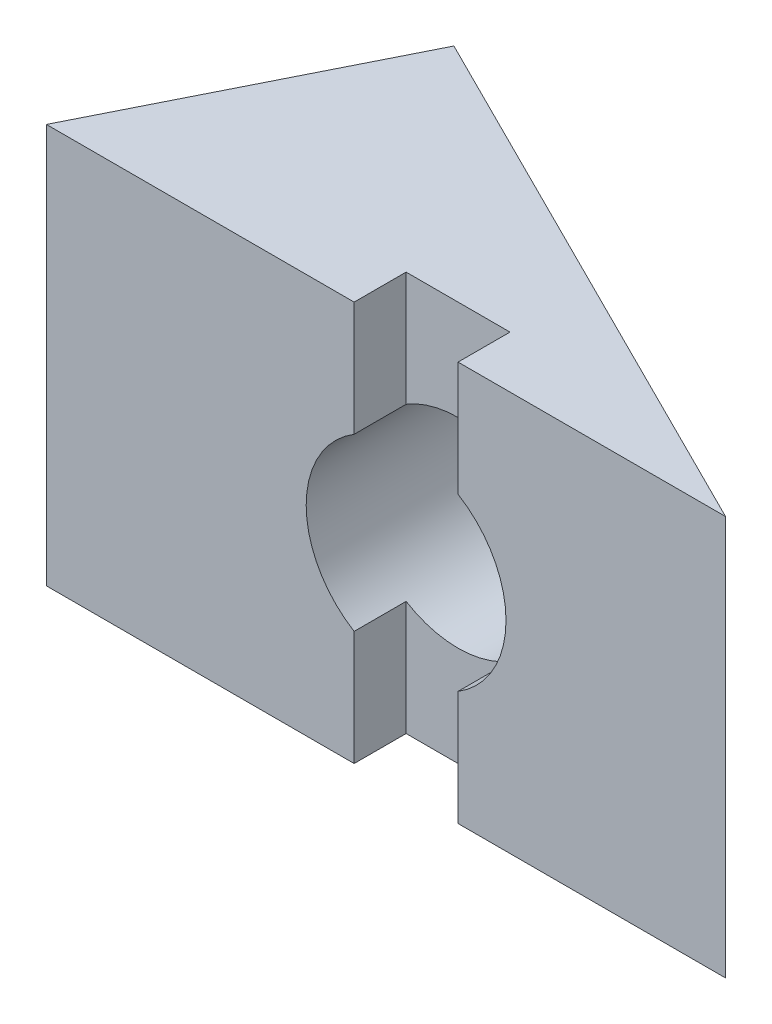
from build123d import *

# Parameters (mm, degrees)
ESTRUSIONE_ESTRUSIONE1_DEPTH = 100
TAGLIO_ESTRUSIONE2_DEPTH     = 13
SCHIZZO5_R                   = 25
TAGLIO_ESTRUSIONE3_DEPTH     = 169.564420887


with BuildPart() as part:
    # Schizzo1 → Estrusione-Estrusione1 (new body)
    with BuildSketch(Plane(origin=(0, 0, 0), x_dir=(1, 0, 0), z_dir=(0, 1, 0))):
        Polygon((-52.496864645, -55.39158852), (117.444301645, -55.39158852), (-18.508631387, 12.584877996), align=None)
    extrude(amount=ESTRUSIONE_ESTRUSIONE1_DEPTH)

    # Schizzo2 → Taglio-Estrusione2 (cut)
    with BuildSketch(Plane.XY.offset(55.39158852)):
        with BuildLine():
            Line((50.503135355, 100), (37.503135355, 100))
            Line((37.503135355, 100), (37.503135355, 75))
            ThreePointArc((37.503135355, 75), (44.253916325, 74.071289045), (50.503135355, 71.354156504))
            Line((50.503135355, 71.354156504), (50.503135355, 100))
        make_face()
        with BuildLine():
            Line((37.503135355, 75), (37.503135355, 100))
            Line((37.503135355, 100), (24.503135355, 100))
            Line((24.503135355, 100), (24.503135355, 71.354156504))
            ThreePointArc((24.503135355, 71.354156504), (30.752354386, 74.071289045), (37.503135355, 75))
        make_face()
        with BuildLine():
            ThreePointArc((50.503135355, 28.645843496), (44.253916325, 25.928710955), (37.503135355, 25))
            Line((37.503135355, 25), (37.503135355, 0))
            Line((37.503135355, 0), (50.503135355, 0))
            Line((50.503135355, 0), (50.503135355, 28.645843496))
        make_face()
        with BuildLine():
            Line((37.503135355, 0), (37.503135355, 25))
            ThreePointArc((37.503135355, 25), (30.752354386, 25.928710955), (24.503135355, 28.645843496))
            Line((24.503135355, 28.645843496), (24.503135355, 0))
            Line((24.503135355, 0), (37.503135355, 0))
        make_face()
    extrude(amount=-TAGLIO_ESTRUSIONE2_DEPTH, mode=Mode.SUBTRACT)

    # Schizzo5 → Taglio-Estrusione3 (cut, through all)
    with BuildSketch(Plane.XY.offset(55.39158852)):
        with Locations((37.503135355, 50)):
            Circle(SCHIZZO5_R)
    extrude(amount=-TAGLIO_ESTRUSIONE3_DEPTH, mode=Mode.SUBTRACT)


solid = part.part
